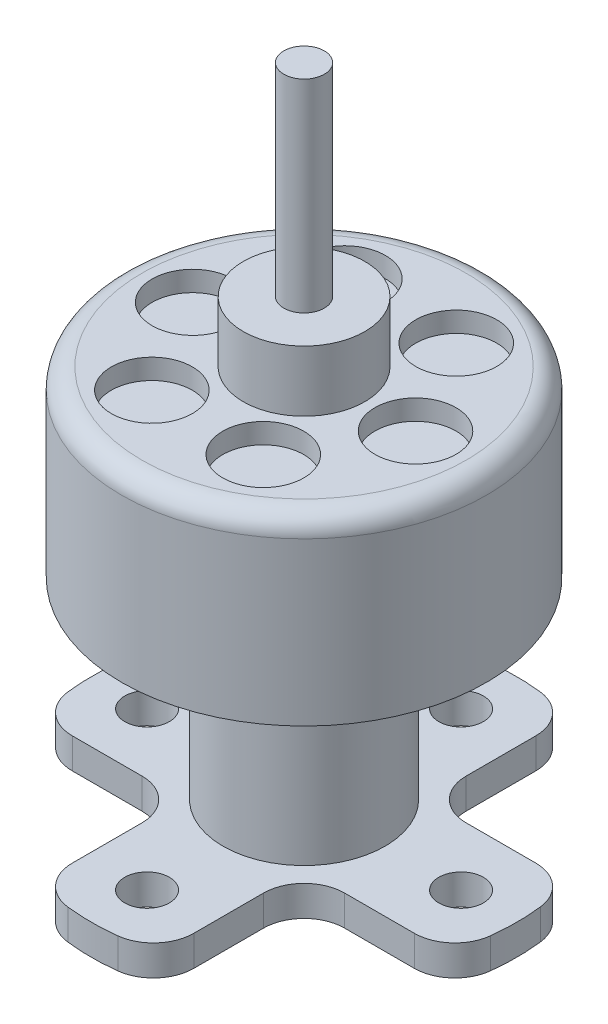
from build123d import *

# Parameters (mm, degrees)
RESSALTO_EXTRUS_O1_DEPTH = 1.5
CORTE_EXTRUS_O1_REACH    = 16.925
ESBO_O2_R                = 1.1
FILETE1_R                = 2
ESBO_O3_R                = 4
RESSALTO_EXTRUS_O2_DEPTH = 9.5
ESBO_O4_R                = 9
RESSALTO_EXTRUS_O3_DEPTH = 9
FILETE2_R                = 1
ESBO_O5_R                = 3
RESSALTO_EXTRUS_O4_DEPTH = 3
ESBO_O6_R                = 1
RESSALTO_EXTRUS_O5_DEPTH = 10
ESBO_O7_R                = 2
CORTE_EXTRUS_O2_DEPTH    = 1


with BuildPart() as part:
    # Esboço1 → Ressalto-extrusão1 (new body)
    with BuildSketch(Plane(origin=(0, 0, 0), x_dir=(1, 0, 0), z_dir=(0, 1, 0))):
        with BuildLine():
            Line((-3, 3), (-3, 10.062305899))
            ThreePointArc((-3, 10.062305899), (0, 10.5), (3, 10.062305899))
            Line((3, 10.062305899), (3, 3))
            Line((3, 3), (10.062305899, 3))
            ThreePointArc((10.062305899, 3), (10.5, 0), (10.062305899, -3))
            Line((10.062305899, -3), (3, -3))
            Line((3, -3), (3, -10.062305899))
            ThreePointArc((3, -10.062305899), (0, -10.5), (-3, -10.062305899))
            Line((-3, -10.062305899), (-3, -3))
            Line((-3, -3), (-10.062305899, -3))
            ThreePointArc((-10.062305899, -3), (-10.5, 0), (-10.062305899, 3))
            Line((-10.062305899, 3), (-3, 3))
        make_face()
    extrude(amount=RESSALTO_EXTRUS_O1_DEPTH)

    # Esboço2 → Corte-extrusão1 (cut, up to next)
    with BuildSketch(Plane(origin=(0, 1.5, 0), x_dir=(1, 0, 0), z_dir=(0, 1, 0)), mode=Mode.PRIVATE) as corte_extrus_o1_sk1:
        with Locations(Location((-7.75, 0, 0), (0, 0, 270))):
            Circle(ESBO_O2_R)
    corte_extrus_o1_tool1 = extrude(corte_extrus_o1_sk1.sketch, amount=-CORTE_EXTRUS_O1_REACH, mode=Mode.PRIVATE) & part.part
    # Esboço2 → Corte-extrusão1 (cut, up to next)
    with BuildSketch(Plane(origin=(0, 1.5, 0), x_dir=(1, 0, 0), z_dir=(0, 1, 0)), mode=Mode.PRIVATE) as corte_extrus_o1_sk2:
        with Locations(Location((0, 7.75, 0), (0, 0, 270))):
            Circle(ESBO_O2_R)
    corte_extrus_o1_tool2 = extrude(corte_extrus_o1_sk2.sketch, amount=-CORTE_EXTRUS_O1_REACH, mode=Mode.PRIVATE) & part.part
    # Esboço2 → Corte-extrusão1 (cut, up to next)
    with BuildSketch(Plane(origin=(0, 1.5, 0), x_dir=(1, 0, 0), z_dir=(0, 1, 0)), mode=Mode.PRIVATE) as corte_extrus_o1_sk3:
        with Locations(Location((7.75, 0, 0), (0, 0, 270))):
            Circle(ESBO_O2_R)
    corte_extrus_o1_tool3 = extrude(corte_extrus_o1_sk3.sketch, amount=-CORTE_EXTRUS_O1_REACH, mode=Mode.PRIVATE) & part.part
    # Esboço2 → Corte-extrusão1 (cut, up to next)
    with BuildSketch(Plane(origin=(0, 1.5, 0), x_dir=(1, 0, 0), z_dir=(0, 1, 0)), mode=Mode.PRIVATE) as corte_extrus_o1_sk4:
        with Locations(Location((0, -7.75, 0), (0, 0, 270))):
            Circle(ESBO_O2_R)
    corte_extrus_o1_tool4 = extrude(corte_extrus_o1_sk4.sketch, amount=-CORTE_EXTRUS_O1_REACH, mode=Mode.PRIVATE) & part.part
    add(corte_extrus_o1_tool1.solids().sort_by_distance((-7.75, 1.5, 0))[0], mode=Mode.SUBTRACT)
    add(corte_extrus_o1_tool2.solids().sort_by_distance((0, 1.5, -7.75))[0], mode=Mode.SUBTRACT)
    add(corte_extrus_o1_tool3.solids().sort_by_distance((7.75, 1.5, 0))[0], mode=Mode.SUBTRACT)
    add(corte_extrus_o1_tool4.solids().sort_by_distance((0, 1.5, 7.75))[0], mode=Mode.SUBTRACT)

    # Filete1
    filete1_edges = [part.edges().sort_by_distance(p)[0] for p in [
        (10.062305899, 0.75, 3),
        (3, 0.75, 3),
        (3, 0.75, 10.062305899),
        (-3, 0.75, 10.062305899),
        (-3, 0.75, 3),
        (-10.062305899, 0.75, 3),
        (-10.062305899, 0.75, -3),
        (-3, 0.75, -3),
        (-3, 0.75, -10.062305899),
        (3, 0.75, -10.062305899),
        (3, 0.75, -3),
        (10.062305899, 0.75, -3),
    ]]
    fillet(filete1_edges, radius=FILETE1_R)

    # Esboço3 → Ressalto-extrusão2 (add)
    with BuildSketch(Plane(origin=(0, 1.5, 0), x_dir=(1, 0, 0), z_dir=(0, 1, 0))):
        with Locations(Location((0, 0, 0), (0, 0, 270))):
            Circle(ESBO_O3_R)
    extrude(amount=RESSALTO_EXTRUS_O2_DEPTH)

    # Esboço4 → Ressalto-extrusão3 (add)
    with BuildSketch(Plane(origin=(0, 11, 0), x_dir=(1, 0, 0), z_dir=(0, 1, 0))):
        with Locations(Location((0, 0, 0), (0, 0, 270))):
            Circle(ESBO_O4_R)
    extrude(amount=RESSALTO_EXTRUS_O3_DEPTH)

    # Filete2
    filete2_edges = [part.edges().sort_by_distance(p)[0] for p in [
        (0, 20, -9),
    ]]
    fillet(filete2_edges, radius=FILETE2_R)

    # Esboço5 → Ressalto-extrusão4 (add)
    with BuildSketch(Plane(origin=(0, 20, 0), x_dir=(1, 0, 0), z_dir=(0, 1, 0))):
        with Locations(Location((0, 0, 0), (0, 0, 270))):
            Circle(ESBO_O5_R)
    extrude(amount=RESSALTO_EXTRUS_O4_DEPTH)

    # Esboço6 → Ressalto-extrusão5 (add)
    with BuildSketch(Plane(origin=(0, 23, 0), x_dir=(1, 0, 0), z_dir=(0, 1, 0))):
        with Locations(Location((0, 0, 0), (0, 0, 270))):
            Circle(ESBO_O6_R)
    extrude(amount=RESSALTO_EXTRUS_O5_DEPTH)

    # Esboço7 → Corte-extrusão2 (cut)
    with BuildSketch(Plane(origin=(0, 20, 0), x_dir=(1, 0, 0), z_dir=(0, 1, 0))):
        with Locations(Location((-5.5, 0, 0), (0, 0, 270))):
            Circle(ESBO_O7_R)
        with Locations(Location((-2.75, 4.763139721, 0), (0, 0, 270))):
            Circle(ESBO_O7_R)
        with Locations(Location((2.75, 4.763139721, 0), (0, 0, 270))):
            Circle(ESBO_O7_R)
        with Locations(Location((5.5, 0, 0), (0, 0, 270))):
            Circle(ESBO_O7_R)
        with Locations(Location((2.75, -4.763139721, 0), (0, 0, 270))):
            Circle(ESBO_O7_R)
        with Locations(Location((-2.75, -4.763139721, 0), (0, 0, 270))):
            Circle(ESBO_O7_R)
    extrude(amount=-CORTE_EXTRUS_O2_DEPTH, mode=Mode.SUBTRACT)


solid = part.part
